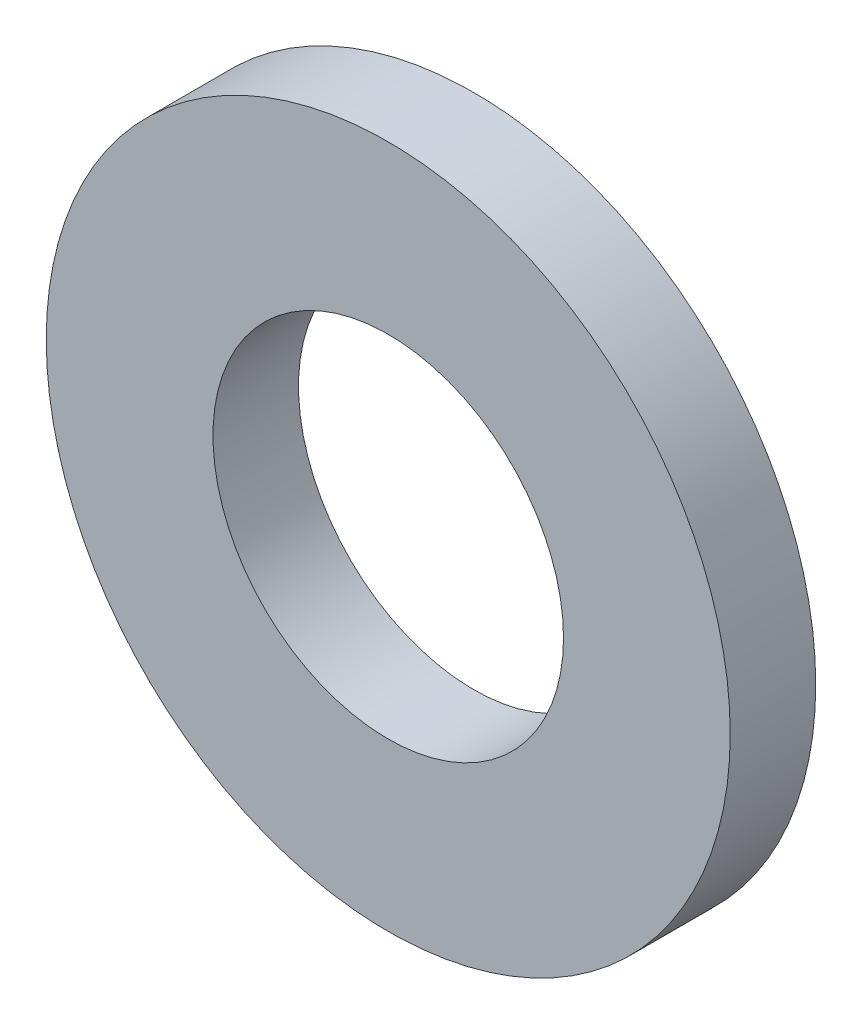
from build123d import *

# Parameters (mm, degrees)
SKETCH1_R           = 4
BOSS_EXTRUDE1_DEPTH = 1
SKETCH2_R           = 2.05
CUT_EXTRUDE1_DEPTH  = 6.744562647


with BuildPart() as part:
    # Sketch1 → Boss-Extrude1 (new body)
    with BuildSketch(Plane.XY):
        Circle(SKETCH1_R)
    extrude(amount=BOSS_EXTRUDE1_DEPTH)

    # Sketch2 → Cut-Extrude1 (cut, through all)
    with BuildSketch(Plane.XY.offset(1)):
        Circle(SKETCH2_R)
    extrude(amount=-CUT_EXTRUDE1_DEPTH, mode=Mode.SUBTRACT)


solid = part.part
